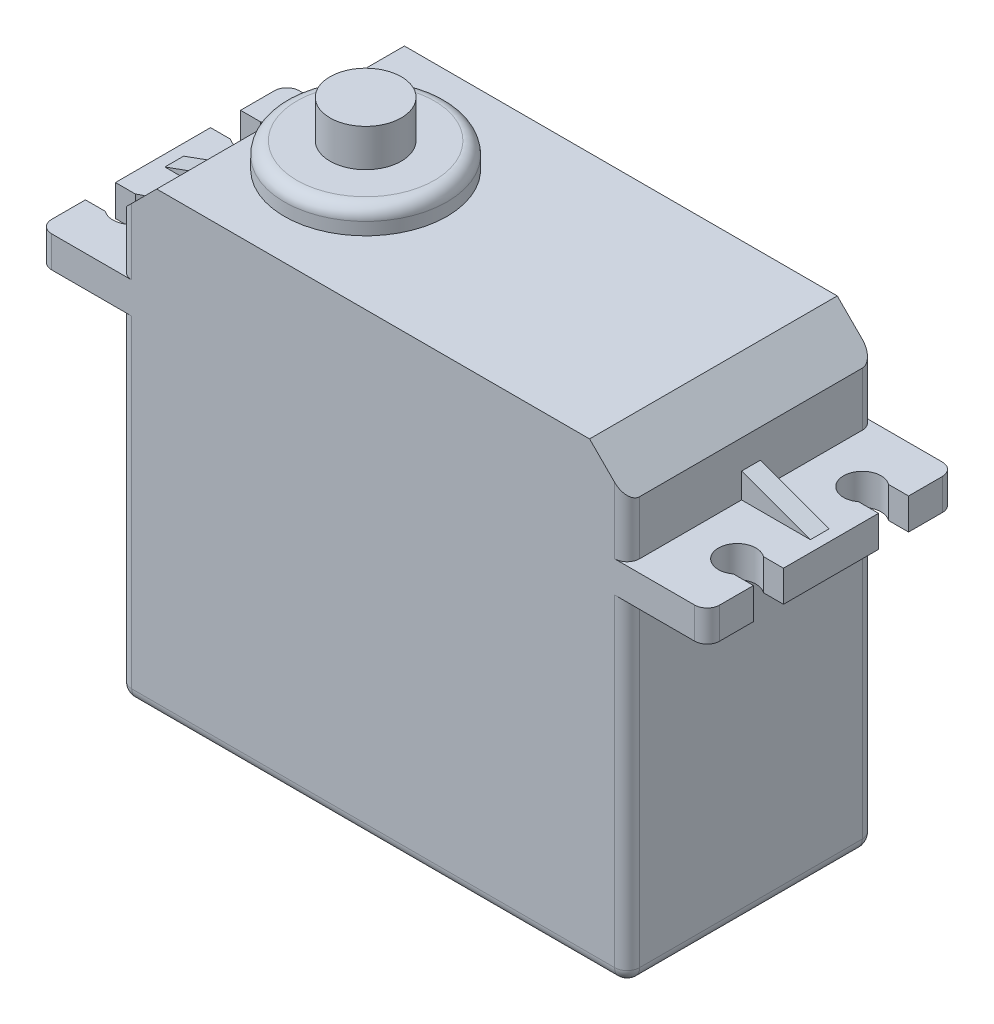
from build123d import *

# Parameters (mm, degrees)
MAIN_SERVO_BODY_DEPTH       = 19.8
SERVO_BRACKET_DEPTH         = 59.817769424
SKETCH3_R                   = 6.5
SERVO_AXIS_1_DEPTH          = 2
SERVO_BRACKET_SUPPORT_DEPTH = 0.75
SKETCH5_R                   = 2.85
SERVO_AXIS_2_DEPTH          = 3
SKETCH6_R                   = 2.5
SERVO_WIRES_DEPTH           = 2
SERVO_CONTOURING_R          = 1


with BuildPart() as part:
    # Sketch1 → Main Servo Body (new body)
    with BuildSketch(Plane.XY):
        Polygon((0, 0), (40.6, 0), (40.6, 26.8), (47, 26.8), (47, 29.3), (40.6, 29.3), (40.6, 33.6), (37.6, 36.6), (3, 36.6), (0, 33.6), (0, 29.3), (-6.4, 29.3), (-6.4, 26.8), (0, 26.8), align=None)
    extrude(amount=MAIN_SERVO_BODY_DEPTH)

    # Sketch2 → Servo Bracket (cut, through all)
    with BuildSketch(Plane(origin=(0, 29.3, 0), x_dir=(1, 0, 0), z_dir=(0, 1, 0))):
        with BuildLine():
            Line((-6.4, -3.7), (-4.8, -3.7))
            ThreePointArc((-4.8, -3.7), (-2.4, -4.9), (-4.8, -6.1))
            Line((-4.8, -6.1), (-6.4, -6.1))
            Line((-6.4, -6.1), (-6.4, -3.7))
        make_face()
        with BuildLine():
            Line((45.4, -3.7), (47, -3.7))
            Line((47, -3.7), (47, -6.1))
            Line((47, -6.1), (45.4, -6.1))
            ThreePointArc((45.4, -6.1), (43, -4.9), (45.4, -3.7))
        make_face()
        with BuildLine():
            Line((45.4, -13.7), (47, -13.7))
            Line((47, -13.7), (47, -16.1))
            Line((47, -16.1), (45.4, -16.1))
            ThreePointArc((45.4, -16.1), (43, -14.9), (45.4, -13.7))
        make_face()
        with BuildLine():
            Line((-6.4, -16.1), (-6.4, -13.7))
            Line((-6.4, -13.7), (-4.8, -13.7))
            ThreePointArc((-4.8, -13.7), (-2.4, -14.9), (-4.8, -16.1))
            Line((-4.8, -16.1), (-6.4, -16.1))
        make_face()
    extrude(amount=-SERVO_BRACKET_DEPTH, mode=Mode.SUBTRACT)

    # Sketch3 → Servo Axis 1 (add)
    with BuildSketch(Plane(origin=(0, 36.6, 0), x_dir=(1, 0, 0), z_dir=(0, 1, 0))):
        with Locations((10, -10.1)):
            Circle(SKETCH3_R)
    extrude(amount=SERVO_AXIS_1_DEPTH)

    # Sketch4 → Servo Bracket Support (add, symmetric)
    with BuildSketch(Plane.XY.offset(9.9)):
        Polygon((-5.5, 29.3), (0, 31.3), (0, 29.3), align=None)
        Polygon((40.6, 29.3), (46.1, 29.3), (40.6, 31.3), align=None)
    extrude(amount=SERVO_BRACKET_SUPPORT_DEPTH, both=True)

    # Sketch5 → Servo Axis 2 (add)
    with BuildSketch(Plane(origin=(0, 38.6, 0), x_dir=(1, 0, 0), z_dir=(0, 1, 0))):
        with Locations(Location((10, -10.1, 0), (0, 0, 270))):
            Circle(SKETCH5_R)
    extrude(amount=SERVO_AXIS_2_DEPTH)

    # Sketch6 → Servo Wires (add)
    with BuildSketch(Plane.ZY):
        with Locations(Location((10.1, 6, 0), (0, 0, 180))):
            Circle(SKETCH6_R)
    extrude(amount=SERVO_WIRES_DEPTH)

    # Servo Contouring
    servo_contouring_edges = [part.edges().sort_by_distance(p)[0] for p in [
        (40.6, 13.4, 19.8),
        (3.5, 38.6, 10.1),
        (-6.4, 28.05, 0),
        (0, 31.45, 0),
        (40.6, 31.45, 0),
        (47, 28.05, 19.8),
        (47, 28.05, 0),
        (40.6, 13.4, 0),
        (20.3, 0, 0),
        (0, 13.4, 0),
        (40.6, 31.45, 19.8),
        (40.6, 0, 9.9),
        (0, 0, 9.9),
        (0, 31.45, 19.8),
        (0, 13.4, 19.8),
        (-6.4, 28.05, 19.8),
        (20.3, 0, 19.8),
    ]]
    fillet(servo_contouring_edges, radius=SERVO_CONTOURING_R)


solid = part.part
